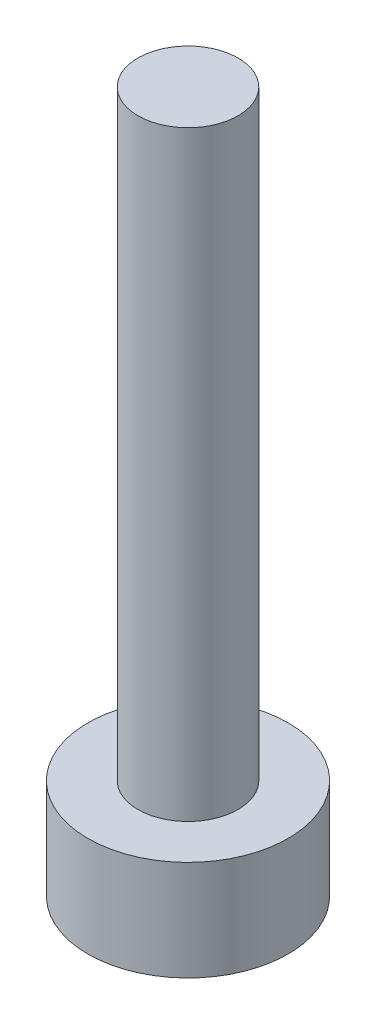
from build123d import *

# Parameters (mm, degrees)
SKETCH_1_R          = 5
EXTRUDE_1_DEPTH     = 5
SKETCH_2_R          = 2.5
EXTRUDE_2_DEPTH     = 30
SKETCH_3_W          = 2.0741403
SKETCH_3_H          = 8.233435191
CUT_EXTRUDE_1_DEPTH = 2


with BuildPart() as part:
    # 草图1 → 凸台-拉伸1 (new body)
    with BuildSketch(Plane(origin=(0, 0, 0), x_dir=(1, 0, 0), z_dir=(0, 1, 0))):
        with Locations(Location((0, 0, 0), (0, 0, 270))):
            Circle(SKETCH_1_R)
    extrude(amount=EXTRUDE_1_DEPTH)

    # 草图2 → 凸台-拉伸2 (add)
    with BuildSketch(Plane(origin=(0, 5, 0), x_dir=(1, 0, 0), z_dir=(0, 1, 0))):
        with Locations(Location((0, 0, 0), (0, 0, 270))):
            Circle(SKETCH_2_R)
    extrude(amount=EXTRUDE_2_DEPTH)

    # 草图3 → 切除-拉伸1 (cut)
    with BuildSketch(Plane.XZ):
        with Locations((0, -0.009018001)):
            Rectangle(SKETCH_3_W, SKETCH_3_H)
    extrude(amount=-CUT_EXTRUDE_1_DEPTH, mode=Mode.SUBTRACT)


solid = part.part
